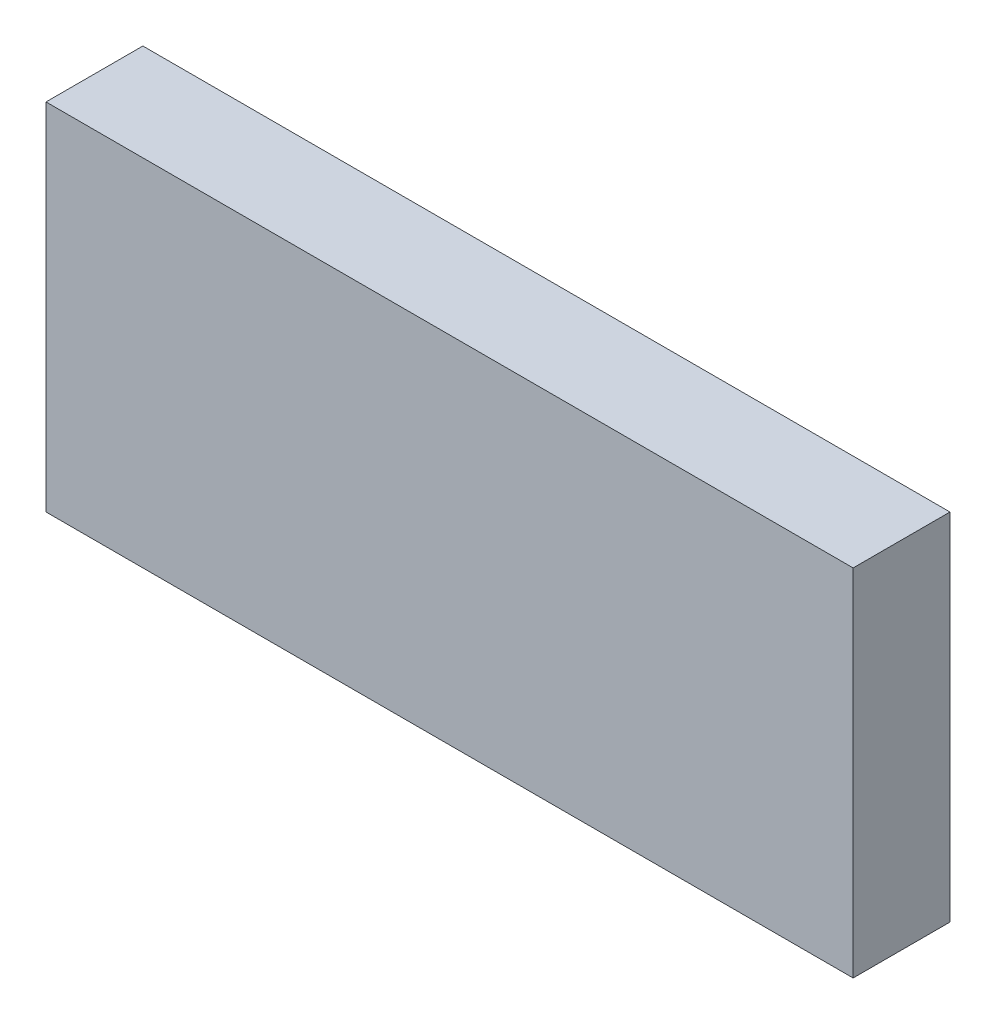
from build123d import *

# Parameters (mm, degrees)
ESQUISSE1_W        = 50
ESQUISSE1_H        = 22
BOSS_EXTRU_1_DEPTH = 6


with BuildPart() as part:
    # Esquisse1 → Boss.-Extru.1 (new body)
    with BuildSketch(Plane.XY):
        with Locations((-25, 11)):
            Rectangle(ESQUISSE1_W, ESQUISSE1_H)
    extrude(amount=BOSS_EXTRU_1_DEPTH)


solid = part.part
